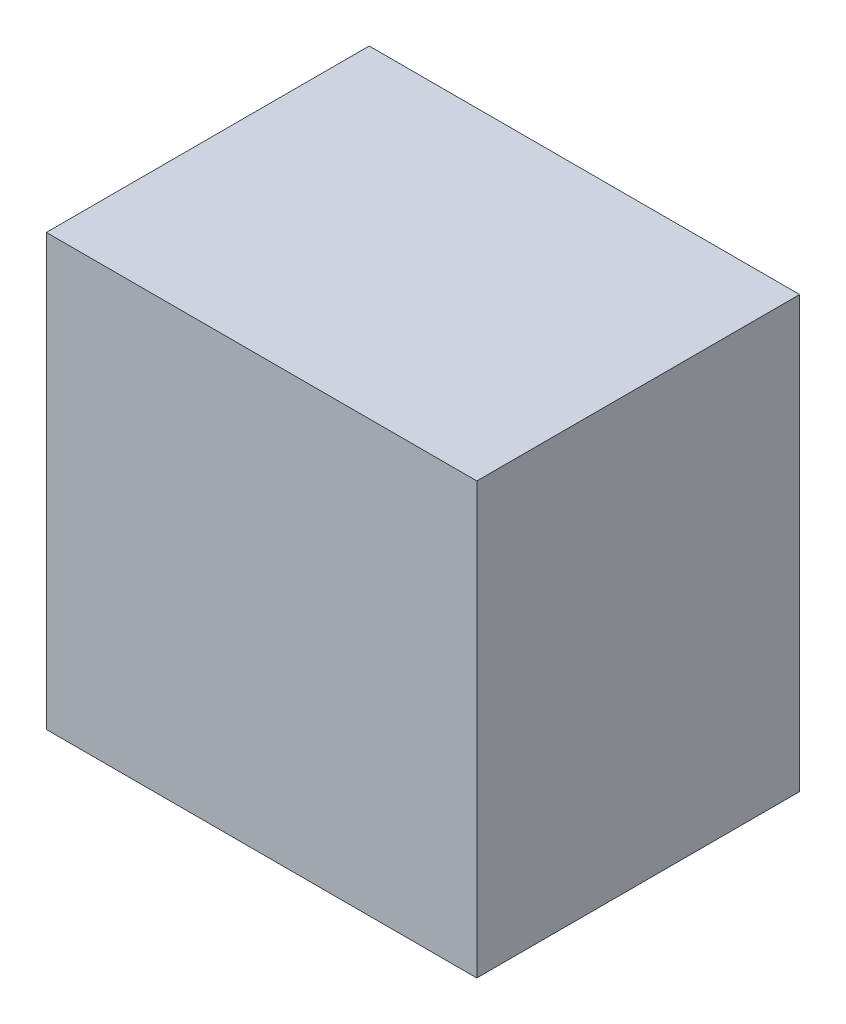
from build123d import *

# Parameters (mm, degrees)
SKETCH1_W           = 40
SKETCH1_H           = 30
BOSS_EXTRUDE1_DEPTH = 40


with BuildPart() as part:
    # Sketch1 → Boss-Extrude1 (new body)
    with BuildSketch(Plane(origin=(0, 0, 0), x_dir=(1, 0, 0), z_dir=(0, 1, 0))):
        Rectangle(SKETCH1_W, SKETCH1_H)
    extrude(amount=BOSS_EXTRUDE1_DEPTH)


solid = part.part
